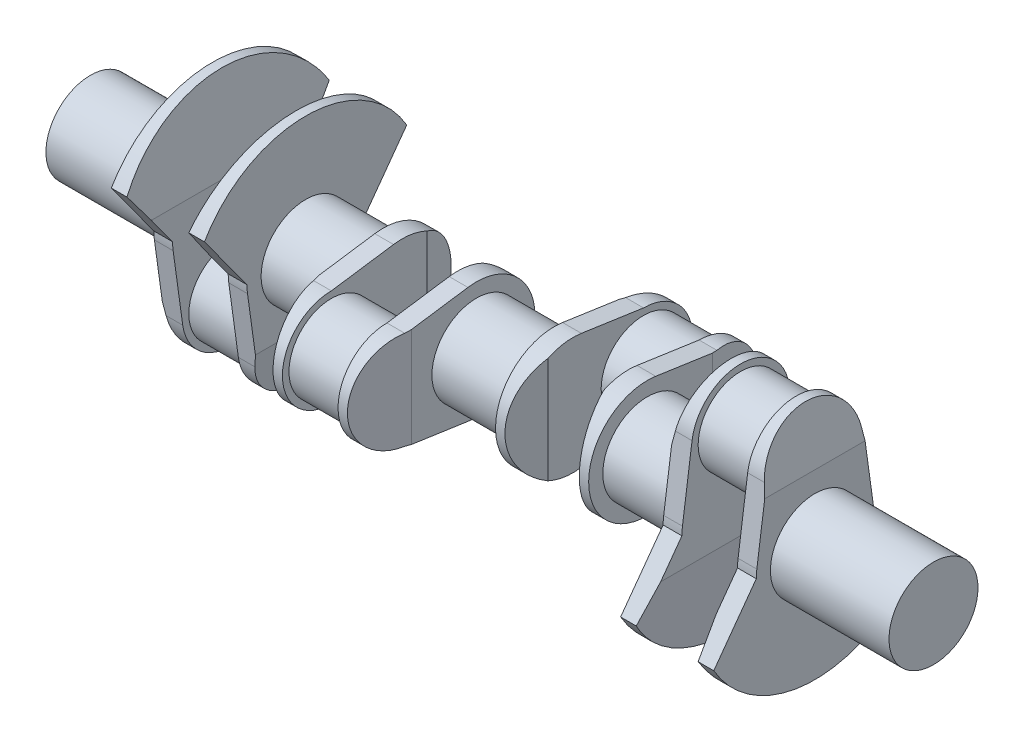
from build123d import *

# Parameters (mm, degrees)
SKETCH1_R               = 40
BOSS_EXTRUDE1_DEPTH     = 106.62
SKETCH2_R               = 44
BOSS_EXTRUDE2_DEPTH     = 16.86
SKETCH3_R               = 38.1
BOSS_EXTRUDE3_DEPTH     = 50
LPATTERN1_COUNT         = 2
LPATTERN1_PITCH         = 66.86
BOSS_EXTRUDE4_START     = -150.688
SKETCH1_2_R             = 40
BOSS_EXTRUDE4_DEPTH     = 66.968
BOSS_EXTRUDE5_DEPTH     = 16.86
SKETCH5_R               = 38.1
BOSS_EXTRUDE6_DEPTH     = 50
LPATTERN2_COUNT         = 2
LPATTERN2_PITCH         = 66.86
BOSS_EXTRUDE7_START     = -304.268
SKETCH1_3_R             = 40
BOSS_EXTRUDE7_DEPTH     = 69.86
BOSS_EXTRUDE8_DEPTH     = 16.86
SKETCH7_R               = 38.1
BOSS_EXTRUDE9_DEPTH     = 50
BOSS_EXTRUDE10_START    = 66.86
BOSS_EXTRUDE10_DEPTH    = 16.86
BOSS_EXTRUDE11_START    = 69.86
SKETCH8_R               = 40
BOSS_EXTRUDE11_DEPTH    = 69.86
SKETCH9_R               = 40
BOSS_EXTRUDE12_DEPTH    = 16.86
SKETCH10_R              = 38.1
BOSS_EXTRUDE13_DEPTH    = 50
BOSS_EXTRUDE14_START    = 66.86
SKETCH9_3_R             = 40
BOSS_EXTRUDE14_DEPTH    = 16.86
BOSS_EXTRUDE15_START    = 193.44
SKETCH9_4_R             = 40
BOSS_EXTRUDE15_DEPTH    = 109.72
CUT_EXTRUDE1_DEPTH      = 669.804560177
CUT_EXTRUDE1_DEPTH_BACK = 669.804560177
CUT_EXTRUDE2_DEPTH      = 669.804560177
CUT_EXTRUDE2_DEPTH_BACK = 669.804560177


with BuildPart() as part:
    # Sketch1 → Boss-Extrude1 (new body)
    with BuildSketch(Plane(origin=(0, 0, 0), x_dir=(0, 0, -1), z_dir=(1, 0, 0))):
        Circle(SKETCH1_R)
    extrude(amount=BOSS_EXTRUDE1_DEPTH)

    # Sketch2 → Boss-Extrude2 (add)
    with BuildSketch(Plane(origin=(0, 0, 0), x_dir=(0, 0, -1), z_dir=(1, 0, 0))):
        with BuildLine():
            Line((52.203036807, 7.220314961), (43.585078169, 69.528346457))
            ThreePointArc((43.585078169, 69.528346457), (43.89614698, 66.521304401), (44, 63.5))
            ThreePointArc((44, 63.5), (-3.021304401, 19.60385302), (-43.585078169, 69.528346457))
            Line((-43.585078169, 69.528346457), (-52.203036807, 7.220314961))
            ThreePointArc((-52.203036807, 7.220314961), (-52.575612406, 3.61869868), (-52.7, 0))
            Line((-52.7, 0), (-90.932667397, -52.5))
            ThreePointArc((-90.932667397, -52.5), (0, -105), (90.932667397, -52.5))
            Line((90.932667397, -52.5), (52.7, 0))
            ThreePointArc((52.7, 0), (52.575612406, 3.61869868), (52.203036807, 7.220314961))
        make_face()
        with Locations((0, 63.5)):
            Circle(SKETCH2_R)
    boss_extrude2 = extrude(amount=-BOSS_EXTRUDE2_DEPTH)

    # Sketch3 → Boss-Extrude3 (add)
    with BuildSketch(Plane.ZY.offset(16.86)):
        with Locations(Location((0, 63.5, 0), (0, 0, 180))):
            Circle(SKETCH3_R)
    extrude(amount=BOSS_EXTRUDE3_DEPTH)

    # LPattern1: Boss-Extrude2 ×2
    with Locations(*[(-i * LPATTERN1_PITCH, 0, 0) for i in range(1, LPATTERN1_COUNT)]):
        add(boss_extrude2)

    # Sketch1<2> → Boss-Extrude4 (add)
    with BuildSketch(Plane(origin=(0, 0, 0), x_dir=(0, 0, -1), z_dir=(1, 0, 0)).offset(BOSS_EXTRUDE4_START)):
        Circle(SKETCH1_2_R)
    extrude(amount=BOSS_EXTRUDE4_DEPTH)

    # Sketch4 → Boss-Extrude5 (add)
    with BuildSketch(Plane.ZY.offset(150.688)):
        with BuildLine():
            Line((-7.602260115, 52.148783698), (-63.5, 44))
            ThreePointArc((-63.5, 44), (-107.5, 0), (-63.5, -44))
            Line((-63.5, -44), (-7.602260115, -52.148783698))
            ThreePointArc((-7.602260115, -52.148783698), (52.7, 0), (-7.602260115, 52.148783698))
        make_face()
    boss_extrude5 = extrude(amount=BOSS_EXTRUDE5_DEPTH)

    # Sketch5 → Boss-Extrude6 (add)
    with BuildSketch(Plane.ZY.offset(167.548)):
        with Locations((-63.5, 0)):
            Circle(SKETCH5_R)
    extrude(amount=BOSS_EXTRUDE6_DEPTH)

    # LPattern2: Boss-Extrude5 ×2
    with Locations(*[(-i * LPATTERN2_PITCH, 0, 0) for i in range(1, LPATTERN2_COUNT)]):
        add(boss_extrude5)

    # Sketch1<3> → Boss-Extrude7 (add)
    with BuildSketch(Plane(origin=(0, 0, 0), x_dir=(0, 0, -1), z_dir=(1, 0, 0)).offset(BOSS_EXTRUDE7_START)):
        Circle(SKETCH1_3_R)
    extrude(amount=BOSS_EXTRUDE7_DEPTH)

    # Sketch6 → Boss-Extrude8 (add)
    with BuildSketch(Plane.ZY.offset(304.268)):
        with BuildLine():
            Line((7.653321337, -52.148783698), (63.551061222, -44))
            ThreePointArc((63.551061222, -44), (107.551061222, 0), (63.551061222, 44))
            Line((63.551061222, 44), (7.653321337, 52.148783698))
            ThreePointArc((7.653321337, 52.148783698), (-52.648938778, 0), (7.653321337, -52.148783698))
        make_face()
    extrude(amount=BOSS_EXTRUDE8_DEPTH)

    # Sketch7 → Boss-Extrude9 (add)
    with BuildSketch(Plane.ZY.offset(321.128)):
        with Locations((63.551061222, 0)):
            Circle(SKETCH7_R)
    extrude(amount=BOSS_EXTRUDE9_DEPTH)

    # Sketch6<2> → Boss-Extrude10 (add)
    with BuildSketch(Plane.ZY.offset(304.268).offset(BOSS_EXTRUDE10_START)):
        with BuildLine():
            Line((7.653321337, -52.148783698), (63.551061222, -44))
            ThreePointArc((63.551061222, -44), (107.551061222, 0), (63.551061222, 44))
            Line((63.551061222, 44), (7.653321337, 52.148783698))
            ThreePointArc((7.653321337, 52.148783698), (-52.648938778, 0), (7.653321337, -52.148783698))
        make_face()
    extrude(amount=BOSS_EXTRUDE10_DEPTH)

    # Sketch8 → Boss-Extrude11 (add)
    with BuildSketch(Plane.ZY.offset(387.988).offset(BOSS_EXTRUDE11_START)):
        with Locations(Location((0, 0, 0), (0, 0, 180))):
            Circle(SKETCH8_R)
    extrude(amount=-BOSS_EXTRUDE11_DEPTH)

    # Sketch9 → Boss-Extrude12 (add)
    # profile 1 of 2: a face of its own
    with BuildSketch(Plane.ZY.offset(457.848)):
        with BuildLine():
            Line((52.7, 0), (90.932667397, 52.5))
            ThreePointArc((90.932667397, 52.5), (0, 105), (-90.932667397, 52.5))
            Line((-90.932667397, 52.5), (-52.7, 0))
            ThreePointArc((-52.7, 0), (-52.575612406, -3.61869868), (-52.203036807, -7.220314961))
            Line((-52.203036807, -7.220314961), (-43.585078169, -69.528346457))
            ThreePointArc((-43.585078169, -69.528346457), (0, -107.5), (43.585078169, -69.528346457))
            Line((43.585078169, -69.528346457), (52.203036807, -7.220314961))
            ThreePointArc((52.203036807, -7.220314961), (52.575612406, -3.61869868), (52.7, 0))
        make_face()
        with Locations(Location((0, 0, 0), (0, 0, 180))):
            Circle(SKETCH9_R, mode=Mode.SUBTRACT)
    # profile 2 of 2: a face of its own
    with BuildSketch(Plane.ZY.offset(457.848)):
        with Locations(Location((0, 0, 0), (0, 0, 180))):
            Circle(SKETCH9_R)
    extrude(amount=BOSS_EXTRUDE12_DEPTH)

    # Sketch10 → Boss-Extrude13 (add)
    with BuildSketch(Plane.ZY.offset(474.708)):
        with Locations((0, -63.5)):
            Circle(SKETCH10_R)
    extrude(amount=BOSS_EXTRUDE13_DEPTH)

    # Sketch9<3> → Boss-Extrude14 (add)
    # profile 1 of 2: a face of its own
    with BuildSketch(Plane.ZY.offset(457.848).offset(BOSS_EXTRUDE14_START)):
        with BuildLine():
            Line((52.7, 0), (90.932667397, 52.5))
            ThreePointArc((90.932667397, 52.5), (0, 105), (-90.932667397, 52.5))
            Line((-90.932667397, 52.5), (-52.7, 0))
            ThreePointArc((-52.7, 0), (-52.575612406, -3.61869868), (-52.203036807, -7.220314961))
            Line((-52.203036807, -7.220314961), (-43.585078169, -69.528346457))
            ThreePointArc((-43.585078169, -69.528346457), (0, -107.5), (43.585078169, -69.528346457))
            Line((43.585078169, -69.528346457), (52.203036807, -7.220314961))
            ThreePointArc((52.203036807, -7.220314961), (52.575612406, -3.61869868), (52.7, 0))
        make_face()
        with Locations(Location((0, 0, 0), (0, 0, 180))):
            Circle(SKETCH9_3_R, mode=Mode.SUBTRACT)
    # profile 2 of 2: a face of its own
    with BuildSketch(Plane.ZY.offset(457.848).offset(BOSS_EXTRUDE14_START)):
        with Locations(Location((0, 0, 0), (0, 0, 180))):
            Circle(SKETCH9_3_R)
    extrude(amount=BOSS_EXTRUDE14_DEPTH)

    # Sketch9<4> → Boss-Extrude15 (add)
    with BuildSketch(Plane.ZY.offset(457.848).offset(BOSS_EXTRUDE15_START)):
        with Locations(Location((0, 0, 0), (0, 0, 180))):
            Circle(SKETCH9_4_R)
    extrude(amount=-BOSS_EXTRUDE15_DEPTH)

    # Sketch11 → Cut-Extrude1 (cut, two sides: drawn at the far end of the back side and taken through both)
    with BuildSketch(Plane.XY.offset(-CUT_EXTRUDE1_DEPTH_BACK)):
        Polygon((-533.138, 105), (-524.708, 105), (-524.708, 26.25), align=None)
        Polygon((-474.708, 105), (-466.278, 105), (-474.708, 26.25), align=None)
        Polygon((-541.568, -107.5), (-533.138, -107.5), (-541.568, -58.5), align=None)
        Polygon((-466.278, -107.5), (-457.848, -107.5), (-457.848, -58.5), align=None)
        Polygon((-75.29, -105), (-66.86, -26.25), (-66.86, -105), align=None)
        Polygon((-16.86, -26.25), (-8.43, -105), (-16.86, -105), align=None)
        Polygon((-8.43, 107.5), (0, 107.5), (0, 58.5), align=None)
        Polygon((-83.72, 107.5), (-75.29, 107.5), (-83.72, 58.5), align=None)
    extrude(amount=CUT_EXTRUDE1_DEPTH + CUT_EXTRUDE1_DEPTH_BACK, mode=Mode.SUBTRACT)

    # Sketch12 → Cut-Extrude2 (cut, two sides: drawn at the far end of the back side and taken through both)
    with BuildSketch(Plane(origin=(0, 0, 0), x_dir=(1, 0, 0), z_dir=(0, 1, 0)).offset(-CUT_EXTRUDE2_DEPTH_BACK)):
        Polygon((-379.558, -107.551061222), (-387.988, -58.551061222), (-387.988, -107.551061222), align=None)
        Polygon((-304.268, -107.551061222), (-304.268, -58.551061222), (-312.698, -107.551061222), align=None)
        Polygon((-379.558, 52.648938778), (-371.128, 52.648938778), (-371.128, 22.49780872), align=None)
        Polygon((-312.698, 52.648938778), (-321.128, 22.49780872), (-321.128, 52.648938778), align=None)
        Polygon((-159.118, 107.5), (-150.688, 107.5), (-150.688, 58.5), align=None)
        Polygon((-225.978, 107.5), (-234.408, 107.5), (-234.408, 58.5), align=None)
        Polygon((-217.548, -52.7), (-225.978, -52.7), (-217.548, -22.548869942), align=None)
        Polygon((-159.118, -52.7), (-167.548, -22.548869942), (-167.548, -52.7), align=None)
    extrude(amount=CUT_EXTRUDE2_DEPTH + CUT_EXTRUDE2_DEPTH_BACK, mode=Mode.SUBTRACT)


solid = part.part
